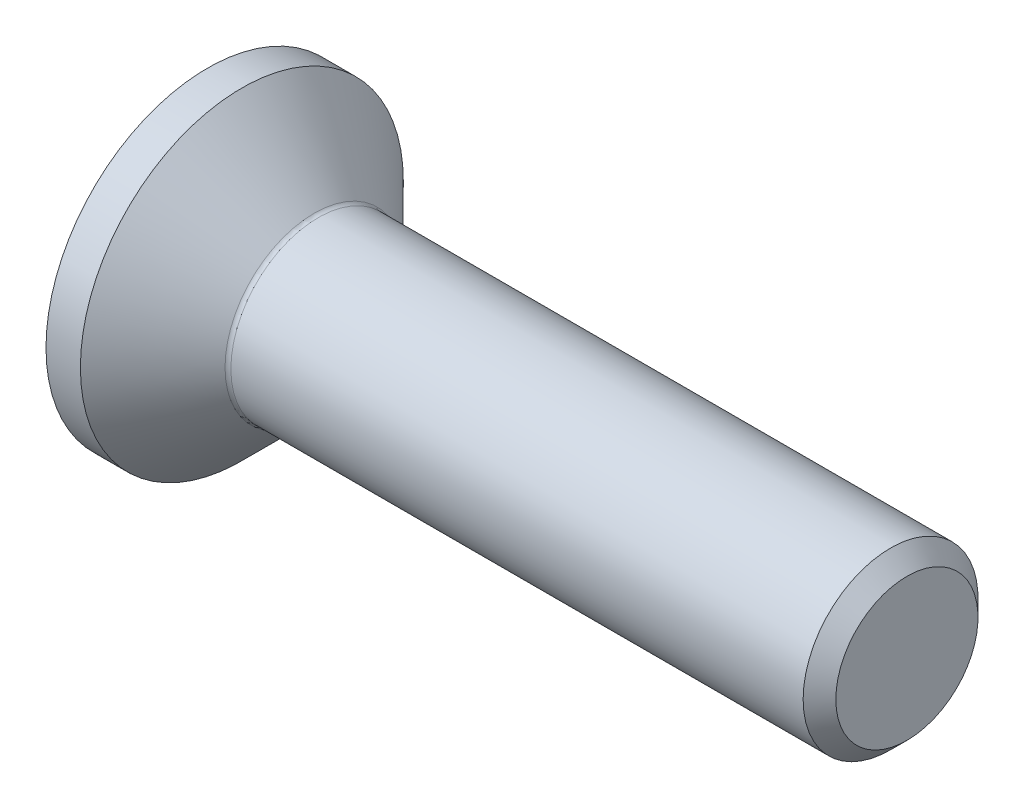
from build123d import *

# Parameters (mm, degrees)
FILLET1_R   = 0.1
HEX_2_DEPTH = 1.1


with BuildPart() as part:
    # BodySke → BaseBody (revolve)
    with BuildSketch(Plane.XY, mode=Mode.PRIVATE) as basebody_sk:
        Polygon((0, 0), (0, 2.77), (0.59, 2.77), (1.86, 1.5), (11.7195, 1.5), (12, 1.2195), (12, 0), align=None)
    revolve(basebody_sk.sketch.rotate(Axis((0, 0, 0), (1, 0, 0)), 90), axis=Axis((0, 0, 0), (1, 0, 0)))

    # Fillet1
    fillet1_edges = [part.edges().sort_by_distance(p)[0] for p in [
        (1.86, 0, -1.5),
    ]]
    fillet(fillet1_edges, radius=FILLET1_R)

    # Sketch2 → PreBroach (revolve, cut)
    with BuildSketch(Plane.XY, mode=Mode.PRIVATE) as prebroach_sk:
        Polygon((0, 1), (1.1, 1), (1.677350269, 0), (0, 0), align=None)
    revolve(prebroach_sk.sketch.rotate(Axis((0, 0, 0), (1, 0, 0)), 90), axis=Axis((0, 0, 0), (1, 0, 0)), mode=Mode.SUBTRACT)

    # Sketch3 → Hex 2 (cut)
    with BuildSketch(Plane.ZY):
        Polygon((-1, -0.577350269), (-1, 0.577350269), (0, 1.154700538), (1, 0.577350269), (1, -0.577350269), (0, -1.154700538), align=None)
    extrude(amount=-HEX_2_DEPTH, mode=Mode.SUBTRACT)


solid = part.part
